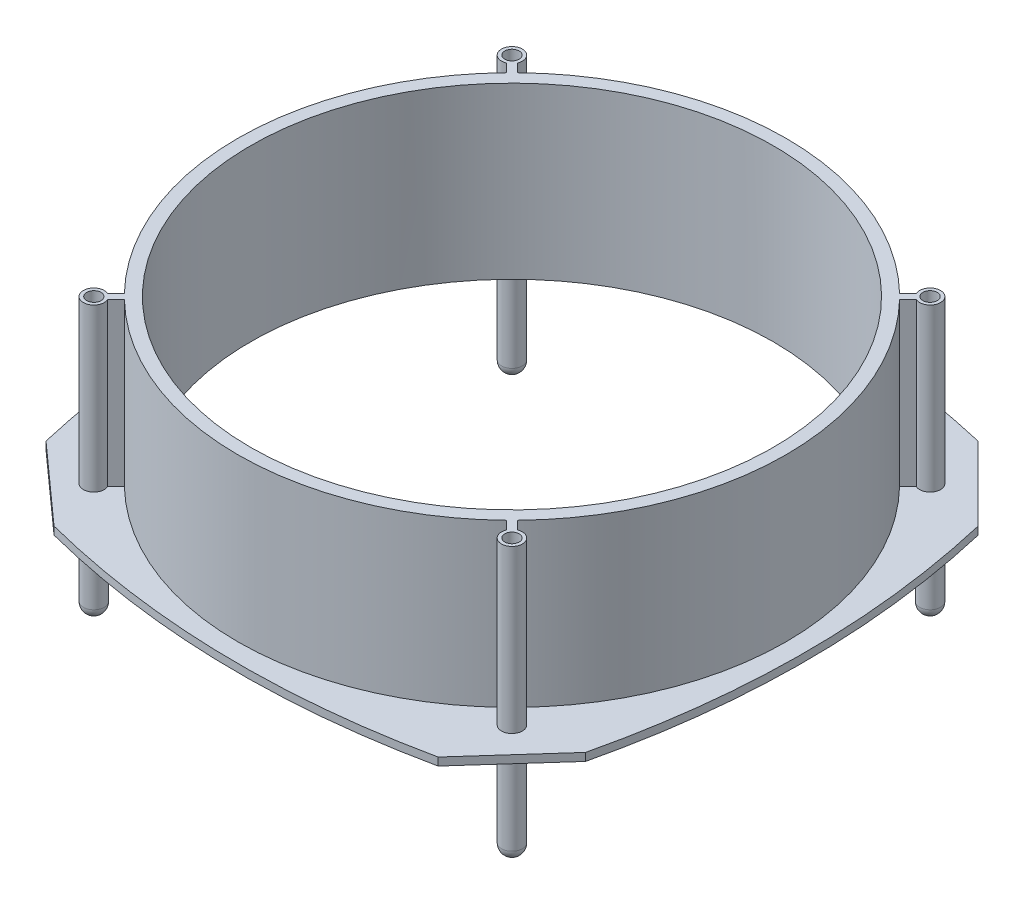
from build123d import *

# Parameters (mm, degrees)
SKETCH2_R                = 5000
BOSS_EXTRUDE2_DEPTH      = 150
SKETCH3_R                = 5244.246539356
BOSS_EXTRUDE3_DEPTH      = 3250
SKETCH7_R                = 200
BOSS_EXTRUDE12_DEPTH     = 3250
BOSS_EXTRUDE13_START     = 2000
SKETCH9_R                = 200
BOSS_EXTRUDE13_DEPTH     = 2000
FILLET1_R                = 200
SKETCH10_R               = 137.445591435
CUT_EXTRUDE2_DEPTH       = 500
EXTRUDE_THIN10_DEPTH     = 3100
CIRPATTERN1_COUNT        = 4
FILLET1_OF_CIRPATTERN1_R = 200
SCALE2_SCALE             = 0.01
SKETCH14_R               = 50
CUT_EXTRUDE4_DEPTH       = 96.047197338


with BuildPart() as part:
    # Sketch2 → Boss-Extrude2 (new body)
    with BuildSketch(Plane(origin=(0, 0, 0), x_dir=(1, 0, 0), z_dir=(0, 1, 0))):
        with BuildLine():
            Line((3824.429393628, -5236.727592336), (5157.692676049, -3749.624245316))
            add(Edge.make_bspline(
                [(5163.968520998, 3752.344435712), (6040.866701019, 0.596942764), (5157.692676049, -3749.624245316)],
                knots=[0, 0, 0, 1, 1, 1], degree=2))
            Line((5163.968520998, 3752.344435712), (3751.208948661, 5164.143902966))
            add(Edge.make_bspline(
                [(-3751.770188441, 5163.582833105), (-0.337562444, 6037.385508755), (3751.208948661, 5164.143902966)],
                knots=[0, 0, 0, 1, 1, 1], degree=2))
            Line((-3751.770188441, 5163.582833105), (-5163.707873982, 3750.961398637))
            add(Edge.make_bspline(
                [(-5163.707873982, 3750.961398637), (-6037.549572471, -0.53895869), (-5163.076160475, -3751.919756157)],
                knots=[0, 0, 0, 1, 1, 1], degree=2))
            Line((-5163.076160475, -3751.919756157), (-3675.972813455, -5085.183038578))
            add(Edge.make_bspline(
                [(-3675.972813455, -5085.183038578), (54.671333271, -6041.022726245), (3824.429393628, -5236.727592336)],
                knots=[0, 0, 0, 1, 1, 1], degree=2))
        make_face()
        Circle(SKETCH2_R, mode=Mode.SUBTRACT)
    extrude(amount=BOSS_EXTRUDE2_DEPTH)

    # Sketch3 → Boss-Extrude3 (add)
    with BuildSketch(Plane(origin=(0, 0, 0), x_dir=(1, 0, 0), z_dir=(0, 1, 0))):
        Circle(SKETCH3_R)
    extrude(amount=BOSS_EXTRUDE3_DEPTH)

    # Sketch7 → Boss-Extrude12 (add)
    with BuildSketch(Plane(origin=(0, 0, 0), x_dir=(-1, 0, 0), z_dir=(0, -1, 0))):
        with Locations((4000, 4000)):
            Circle(SKETCH7_R)
    boss_extrude12 = extrude(amount=-BOSS_EXTRUDE12_DEPTH)

    # Sketch9 → Boss-Extrude13 (add)
    with BuildSketch(Plane(origin=(0, 0, 0), x_dir=(-1, 0, 0), z_dir=(0, -1, 0)).offset(BOSS_EXTRUDE13_START)):
        with Locations((4000, 4000)):
            Circle(SKETCH9_R)
    boss_extrude13 = extrude(amount=-BOSS_EXTRUDE13_DEPTH)

    # Fillet1
    fillet1_edges = [part.edges().sort_by_distance(p)[0] for p in [
        (-3800, 0, -4000),
        (-3800, -2000, -4000),
    ]]
    fillet(fillet1_edges, radius=FILLET1_R)

    # Sketch10 → Cut-Extrude2 (cut)
    with BuildSketch(Plane(origin=(0, 3250, 0), x_dir=(1, 0, 0), z_dir=(0, 1, 0))):
        with Locations((-4000, 4000)):
            Circle(SKETCH10_R)
    cut_extrude2 = extrude(amount=-CUT_EXTRUDE2_DEPTH, mode=Mode.SUBTRACT)

    # Sketch13 → Extrude-Thin10 (add)
    with BuildSketch(Plane(origin=(0, 150, 0), x_dir=(1, 0, 0), z_dir=(0, 1, 0))):
        Polygon((-3817.148931735, 3918.972308226), (-3656.98109375, 3758.804470241), (-3707.892781996, 3707.892781996), (-3868.06061998, 3868.06061998), align=None)
        Polygon((-3758.804470241, 3656.98109375), (-3918.972308226, 3817.148931735), (-3868.06061998, 3868.06061998), (-3707.892781996, 3707.892781996), align=None)
    extrude_thin10 = extrude(amount=EXTRUDE_THIN10_DEPTH)

    # CirPattern1: Boss-Extrude12, Boss-Extrude13, Cut-Extrude2, Extrude-Thin10 ×4 about axis
    cirpattern1_axis = Axis((0, 3250, 0), (0, -1, 0))
    add([boss_extrude12.rotate(cirpattern1_axis, i * 360 / CIRPATTERN1_COUNT) for i in range(1, CIRPATTERN1_COUNT)])
    add([boss_extrude13.rotate(cirpattern1_axis, i * 360 / CIRPATTERN1_COUNT) for i in range(1, CIRPATTERN1_COUNT)])
    add([cut_extrude2.rotate(cirpattern1_axis, i * 360 / CIRPATTERN1_COUNT) for i in range(1, CIRPATTERN1_COUNT)], mode=Mode.SUBTRACT)
    add([extrude_thin10.rotate(cirpattern1_axis, i * 360 / CIRPATTERN1_COUNT) for i in range(1, CIRPATTERN1_COUNT)])

    # Fillet1 of CirPattern1
    fillet1_of_cirpattern1_edges = [part.edges().sort_by_distance(p)[0] for p in [
        (4000, 0, -3800),
        (4000, -2000, -3800),
        (3800, 0, 4000),
        (3800, -2000, 4000),
        (-4000, 0, 3800),
        (-4000, -2000, 3800),
    ]]
    fillet(fillet1_of_cirpattern1_edges, radius=FILLET1_OF_CIRPATTERN1_R)


with BuildPart() as part_1:
    # Scale2: scaled about (0, 0, 0)
    add(part.part.scale(SCALE2_SCALE))

    # Sketch14 → Cut-Extrude4 (cut, through all)
    with BuildSketch(Plane(origin=(0, 32.5, 0), x_dir=(1, 0, 0), z_dir=(0, 1, 0))):
        Circle(SKETCH14_R)
    extrude(amount=-CUT_EXTRUDE4_DEPTH, mode=Mode.SUBTRACT)


solid = part_1.part
